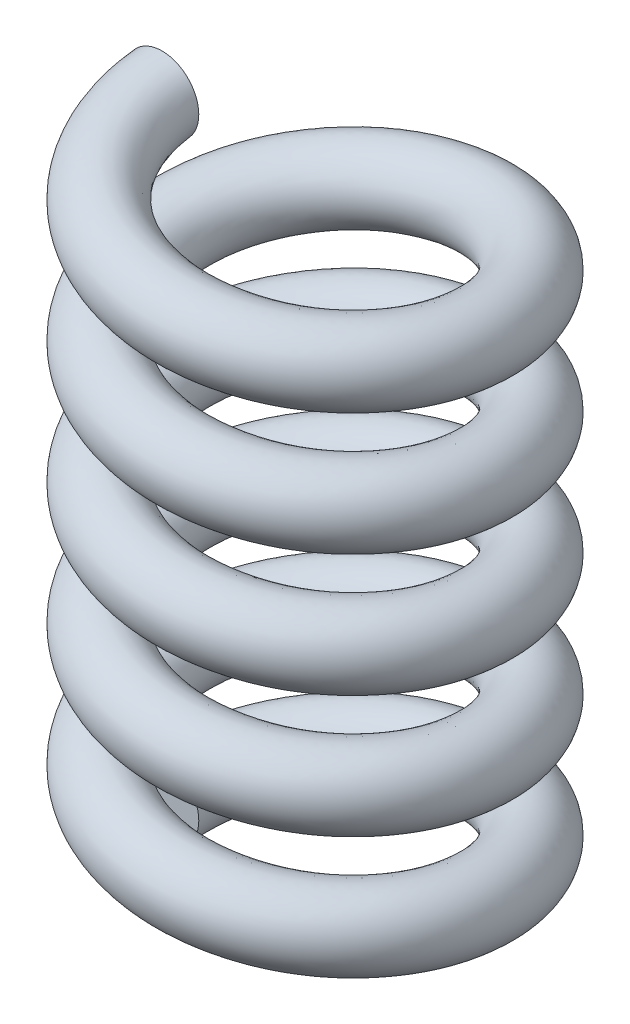
from build123d import *

# Parameters (mm, degrees)
SWEEP1_PITCH       = 2
SWEEP1_HEIGHT      = 10
SWEEP1_RADIUS      = 2.5
SWEEP1_START_ANGLE = -90
SKETCH1_R          = 0.6


with BuildPart() as part:
    # Sweep1: sweep along a helix
    with BuildLine() as sweep1_path:
        add(Helix(SWEEP1_PITCH, SWEEP1_HEIGHT, SWEEP1_RADIUS, center=(2.5, 0, 0), direction=(0, 1, 0), lefthand=True, mode=Mode.PRIVATE).rotate(Axis((2.5, 0, 0), (0, 1, 0)), SWEEP1_START_ANGLE))
    # Sketch1 → Sweep1 (sweep)
    with BuildSketch(Plane.XY):
        Circle(SKETCH1_R)
    sweep(path=sweep1_path.line, is_frenet=True)


solid = part.part
